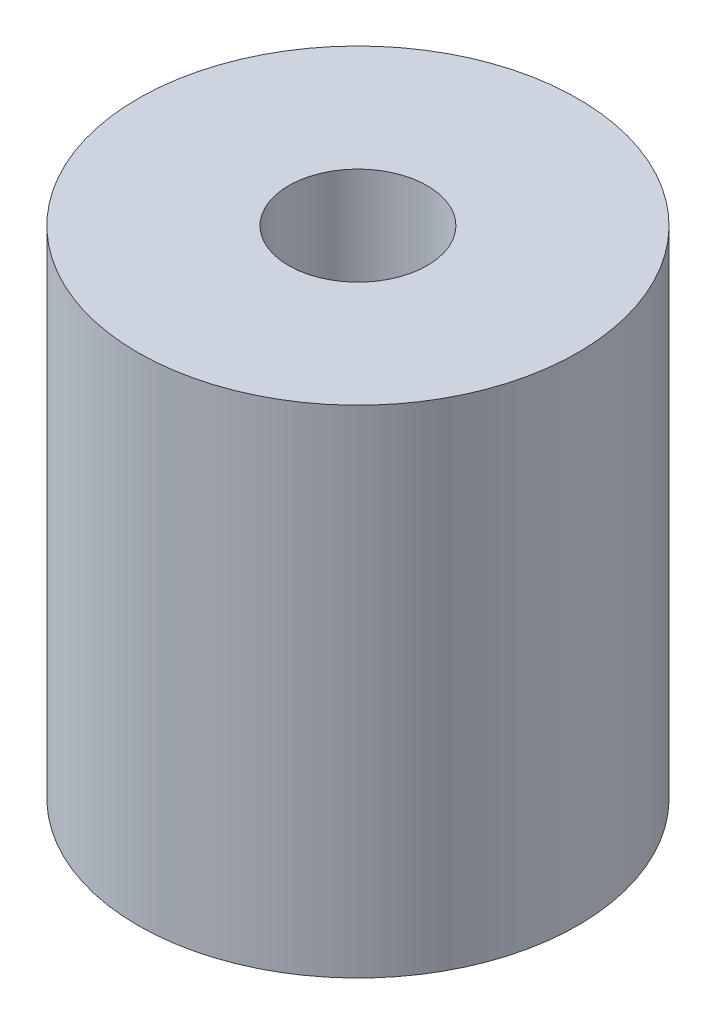
from build123d import *

# Parameters (mm, degrees)
SKETCH1_R           = 5
SKETCH1_R_2         = 1.575
BOSS_EXTRUDE1_DEPTH = 11.275


with BuildPart() as part:
    # Sketch1 → Boss-Extrude1 (new body)
    with BuildSketch(Plane(origin=(0, 0, 0), x_dir=(1, 0, 0), z_dir=(0, 1, 0))):
        with Locations(Location((0, 0, 0), (0, 0, 270))):
            Circle(SKETCH1_R)
        with Locations(Location((0, 0, 0), (0, 0, 270))):
            Circle(SKETCH1_R_2, mode=Mode.SUBTRACT)
    extrude(amount=BOSS_EXTRUDE1_DEPTH)


solid = part.part
